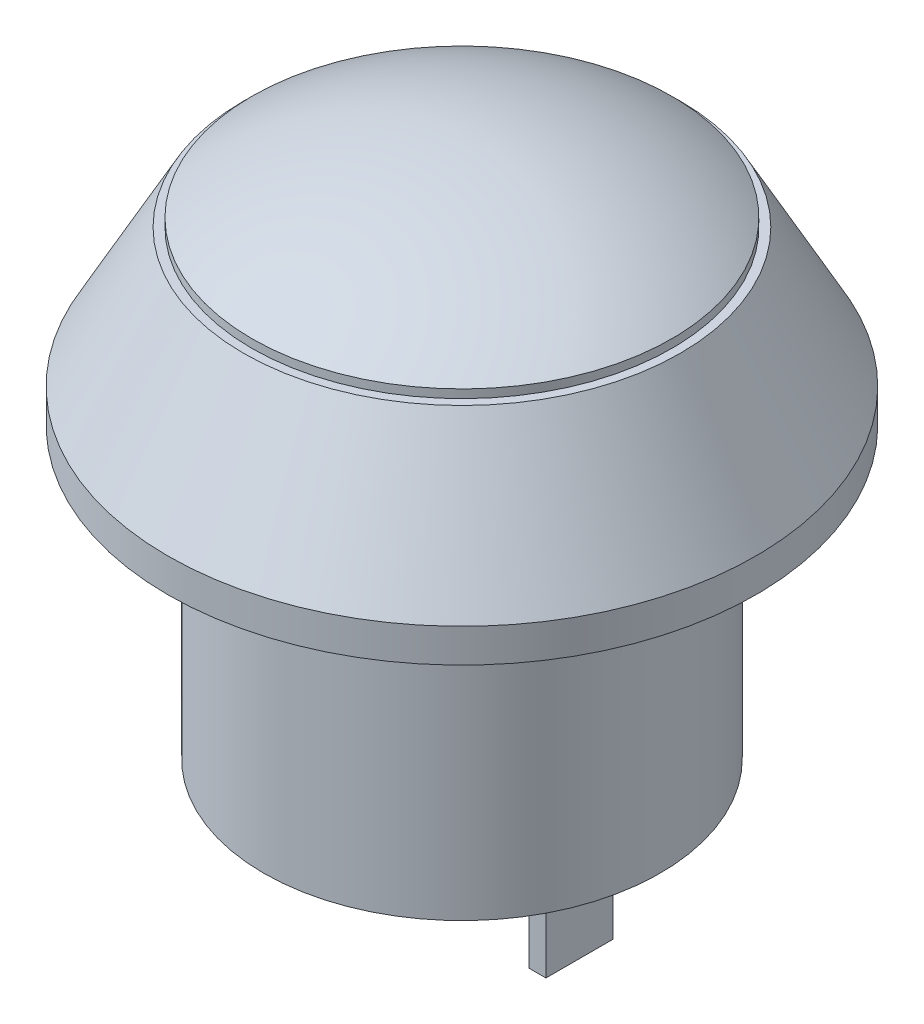
from build123d import *

# Parameters (mm, degrees)
SKETCH2_R           = 5.9
BOSS_EXTRUDE1_DEPTH = 8.6
SKETCH3_W           = 0.5
SKETCH3_H           = 2
BOSS_EXTRUDE2_DEPTH = 3.4


with BuildPart() as part:
    # Sketch1 → Revolve1 (revolve)
    with BuildSketch(Plane.XY, mode=Mode.PRIVATE) as revolve1_sk:
        with BuildLine():
            Line((0, 0), (-8.75, 0))
            Line((-8.75, 0), (-8.75, 1))
            Line((-8.75, 1), (-6.5, 5.1))
            Line((-6.5, 5.1), (-6.25, 5.1))
            Line((-6.25, 5.1), (-6.25, 5.35))
            ThreePointArc((-6.25, 5.35), (-3.273568389, 6.801180735), (0, 7.3))
            Line((0, 7.3), (0, 0))
        make_face()
    revolve(revolve1_sk.sketch.rotate(Axis((0, 7.3, 0), (0, -1, 0)), 270), axis=Axis((0, 7.3, 0), (0, -1, 0)))

    # Sketch2 → Boss-Extrude1 (add)
    with BuildSketch(Plane.XZ):
        with Locations(Location((0, 0, 0), (0, 0, 90))):
            Circle(SKETCH2_R)
    extrude(amount=BOSS_EXTRUDE1_DEPTH)

    # Sketch3 → Boss-Extrude2 (add)
    with BuildSketch(Plane.XZ.offset(8.6)):
        with Locations((-3.25, 0)):
            Rectangle(SKETCH3_W, SKETCH3_H)
        with Locations((3.25, 0)):
            Rectangle(SKETCH3_W, SKETCH3_H)
    extrude(amount=BOSS_EXTRUDE2_DEPTH)


solid = part.part
